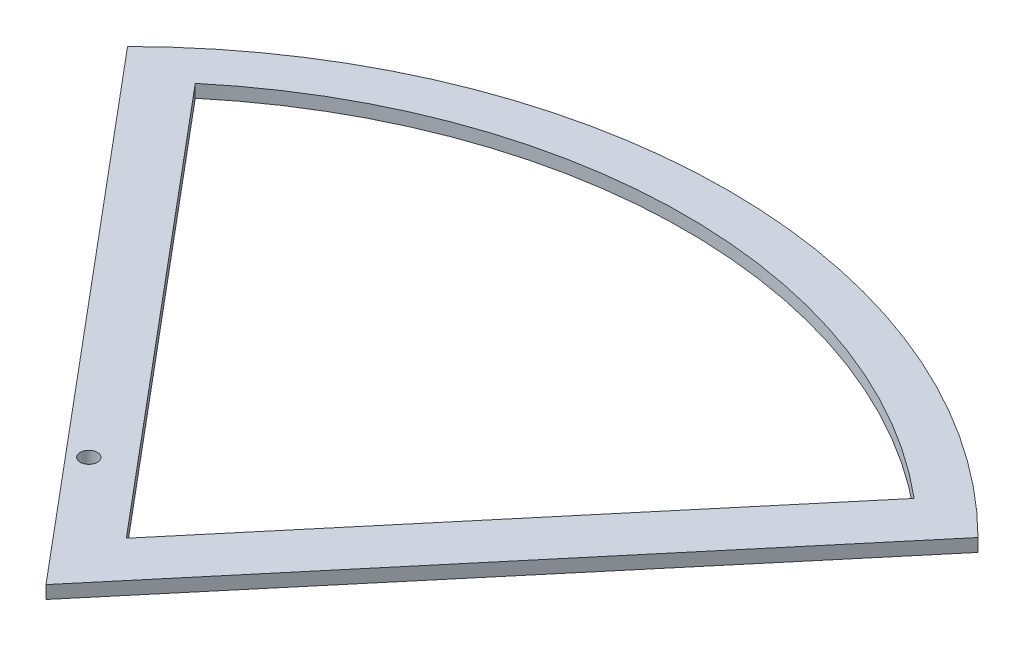
from build123d import *

# Parameters (mm, degrees)
DODANIE_WYCI_GNI_CIE1_DEPTH = 1.5
OTWORY_USTALAJ_CE_4_0MM1_D  = 4


with BuildPart() as part:
    # Szkic1 → Dodanie-wyciągnięcie1 (new, symmetric)
    with BuildSketch(Plane(origin=(0, 0, 0), x_dir=(1, 0, 0), z_dir=(0, 1, 0))):
        with BuildLine():
            Line((-98.851612767, 99.138078726), (0, -18.668685922))
            Line((0, -18.668685922), (98.851612767, 99.138078726))
            ThreePointArc((98.851612767, 99.138078726), (94.507932102, 103.28722462), (89.990265356, 107.246222037))
            ThreePointArc((89.990265356, 107.246222037), (0, 140), (-89.990265356, 107.246222037))
            ThreePointArc((-89.990265356, 107.246222037), (-94.507932102, 103.28722462), (-98.851612767, 99.138078726))
        make_face()
        with BuildLine():
            Line((0, 0), (-83.562389259, 99.585777605))
            ThreePointArc((-83.562389259, 99.585777605), (0, 130), (83.562389259, 99.585777605))
            Line((83.562389259, 99.585777605), (0, 0))
        make_face(mode=Mode.SUBTRACT)
    extrude(amount=DODANIE_WYCI_GNI_CIE1_DEPTH, both=True)

    # Otwory ustalające Ø4.0mm1 (through all)
    with Locations(Plane(origin=(0, 1.5, 0), x_dir=(1, 0, 0), z_dir=(0, 1, 0))):
        with Locations((65, 50), (-65, 50), (-20.649569124, 11.932485481)):
            Hole(OTWORY_USTALAJ_CE_4_0MM1_D / 2)


solid = part.part
